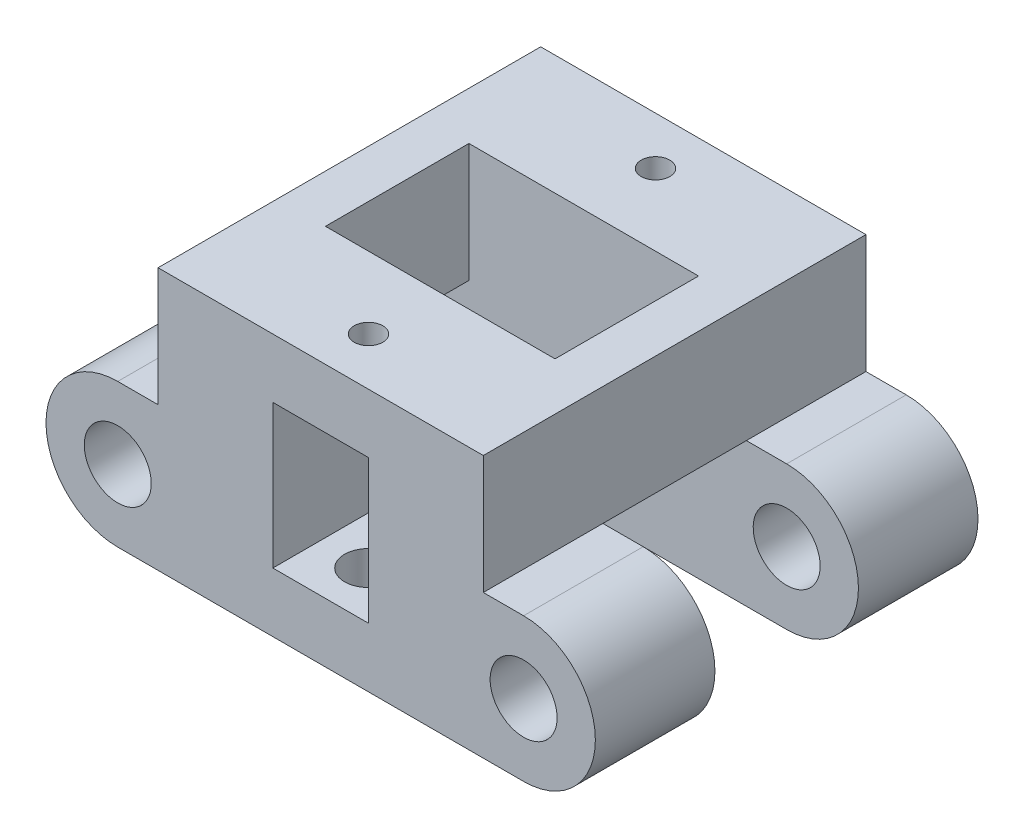
from build123d import *

# Parameters (mm, degrees)
BOSS_EXTRUDE1_DEPTH               = 25.4
BOSS_EXTRUDE1_DEPTH_BACK          = 25.4
SKETCH1_R                         = 4.445
SKETCH9_W                         = 30.48
SKETCH9_H                         = 35.052
CUT_EXTRUDE6_DEPTH                = 75.08914513
BOSS_EXTRUDE3_DEPTH               = 12.7
SKETCH11_W                        = 5.350768363
SKETCH11_H                        = 57.15
CUT_EXTRUDE7_DEPTH                = 94.35417198
SKETCH12_W                        = 30.48
SKETCH12_H                        = 19.05
CUT_EXTRUDE8_DEPTH                = 93.670395825
SKETCH14_R                        = 1.6
CUT_EXTRUDE9_DEPTH                = 81.005571081
SKETCH15_R                        = 3.429
CUT_EXTRUDE10_DEPTH               = 81.005571081
CUT_EXTRUDE11_DEPTH               = 2.778125
SKETCH22_W                        = 1.89865
SKETCH22_H                        = 38.369875
SKETCH23_R                        = 3.175
CUT_EXTRUDE12_DEPTH               = 22.225
SKETCH24_W                        = 43.18
SKETCH24_H                        = 41.402
CUT_EXTRUDE13_DEPTH               = 94.35417198
CUT_EXTRUDE14_REACH               = 74.389
SKETCH25_W                        = 12.7
SKETCH25_H                        = 19.05
CUT_EXTRUDE15_DEPTH               = 74.112136493
CUT_EXTRUDE15_DEPTH_BACK          = 74.112136493
SKETCH26_W                        = 19.05
SKETCH26_H                        = 61.020370042
F_25_0_1495_DIAMETER_HOLE1_REACH  = 58.443
F_25_0_1495_DIAMETER_HOLE1_BORE_R = 1.89865


with BuildPart() as part:
    # Sketch1 → Boss-Extrude1 (new, two sides: drawn at the far end of the back side and taken through both)
    with BuildSketch(Plane.XY.offset(-BOSS_EXTRUDE1_DEPTH_BACK)):
        with BuildLine():
            Line((-26.940768363, -17.415768363), (-26.940768363, 39.734231637))
            Line((-26.940768363, 39.734231637), (26.940768363, 39.734231637))
            Line((26.940768363, 39.734231637), (26.940768363, -17.415768363))
            ThreePointArc((26.940768363, -17.415768363), (36.465768363, -26.940768363), (26.940768363, -36.465768363))
            Line((26.940768363, -36.465768363), (-26.940768363, -36.465768363))
            ThreePointArc((-26.940768363, -36.465768363), (-36.465768363, -26.940768363), (-26.940768363, -17.415768363))
        make_face()
        with Locations((-26.940768363, -26.940768363)):
            Circle(SKETCH1_R, mode=Mode.SUBTRACT)
        with Locations((26.940768363, -26.940768363)):
            Circle(SKETCH1_R, mode=Mode.SUBTRACT)
    extrude(amount=BOSS_EXTRUDE1_DEPTH + BOSS_EXTRUDE1_DEPTH_BACK)

    # Sketch9 → Cut-Extrude6 (cut, through all)
    with BuildSketch(Plane.XY.offset(25.4)):
        with Locations((0, 22.208231637)):
            Rectangle(SKETCH9_W, SKETCH9_H)
    extrude(amount=-CUT_EXTRUDE6_DEPTH, mode=Mode.SUBTRACT)

    # Sketch10 → Boss-Extrude3 (add)
    with BuildSketch(Plane.XY.offset(25.4)):
        Polygon((-26.940768363, 39.734231637), (-26.940768363, -1.667768363), (26.940768363, -1.667768363), (26.940768363, 39.734231637), (15.24, 39.734231637), (15.24, 4.682231637), (-15.24, 4.682231637), (-15.24, 39.734231637), align=None)
    boss_extrude3 = extrude(amount=BOSS_EXTRUDE3_DEPTH)

    # Mirror4: Boss-Extrude3 across plane
    add(boss_extrude3.mirror(Plane.XY))

    # Sketch11 → Cut-Extrude7 (cut, through all)
    with BuildSketch(Plane.XY.offset(38.1)):
        with Locations((-24.265384181, 11.159231637)):
            Rectangle(SKETCH11_W, SKETCH11_H)
    cut_extrude7 = extrude(amount=-CUT_EXTRUDE7_DEPTH, mode=Mode.SUBTRACT)

    # Mirror5: Cut-Extrude7 across plane
    add(cut_extrude7.mirror(Plane(origin=(0, 0, 0), x_dir=(0, 0, 1), z_dir=(1, 0, 0))), mode=Mode.SUBTRACT)

    # Sketch12 → Cut-Extrude8 (cut, through all)
    with BuildSketch(Plane.XZ.offset(36.465768363)):
        Rectangle(SKETCH12_W, SKETCH12_H)
    extrude(amount=-CUT_EXTRUDE8_DEPTH, mode=Mode.SUBTRACT)

    # Sketch14 → Cut-Extrude9 (cut, through all)
    with BuildSketch(Plane.ZY.offset(21.59)):
        with Locations(Location((-18.4, 22.462231637, 0), (0, 0, 90))):
            Circle(SKETCH14_R)
    cut_extrude9 = extrude(amount=-CUT_EXTRUDE9_DEPTH, mode=Mode.SUBTRACT)

    # Mirror6: Cut-Extrude9 across plane
    add(cut_extrude9.mirror(Plane.XY), mode=Mode.SUBTRACT)

    # Sketch15 → Cut-Extrude10 (cut, through all)
    with BuildSketch(Plane(origin=(21.59, 0, 0), x_dir=(0, 0, -1), z_dir=(1, 0, 0))):
        with Locations(Location((0, 22.462231637, 0), (0, 0, 90))):
            Circle(SKETCH15_R)
    extrude(amount=-CUT_EXTRUDE10_DEPTH, mode=Mode.SUBTRACT)

    # Sketch18 → Cut-Extrude11 (cut)
    with BuildSketch(Plane(origin=(0, 4.682231637, 0), x_dir=(1, 0, 0), z_dir=(0, 1, 0))):
        Polygon((-15.24, 2.346351494), (-19.304, 4.692702988), (-23.368, 2.346351494), (-23.368, -2.346351494), (-19.304, -4.692702988), (-15.24, -2.346351494), align=None)
    cut_extrude11 = extrude(amount=-CUT_EXTRUDE11_DEPTH, mode=Mode.SUBTRACT)

    # Mirror7: Cut-Extrude11 across plane
    add(cut_extrude11.mirror(Plane(origin=(0, 0, 0), x_dir=(0, 0, 1), z_dir=(1, 0, 0))), mode=Mode.SUBTRACT)

    # Sketch22 → #6 Clearance Hole1 (revolve, cut)
    with BuildSketch(Plane(origin=(0, 1.904106637, -19.05), x_dir=(0, 0, 1), z_dir=(1, 0, 0))):
        with Locations((0.949325, 19.1849375)):
            Rectangle(SKETCH22_W, SKETCH22_H)
    f_6_clearance_hole1 = revolve(axis=Axis((0, 8.254106637, -19.05), (0, -1, 0)), mode=Mode.SUBTRACT)

    # Mirror8: #6 Clearance Hole1 across plane
    add(f_6_clearance_hole1.mirror(Plane.XY), mode=Mode.SUBTRACT)

    # Sketch23 → Cut-Extrude12 (cut)
    with BuildSketch(Plane.XZ.offset(36.465768363)):
        with Locations(Location((0, -19.05, 0), (0, 0, 270))):
            Circle(SKETCH23_R)
        with Locations(Location((0, 19.05, 0), (0, 0, 270))):
            Circle(SKETCH23_R)
    extrude(amount=-CUT_EXTRUDE12_DEPTH, mode=Mode.SUBTRACT)

    # Sketch24 → Cut-Extrude13 (cut, through all)
    with BuildSketch(Plane(origin=(0, 0, -38.1), x_dir=(-1, 0, 0), z_dir=(0, 0, -1))):
        with Locations((0, 19.033231637)):
            Rectangle(SKETCH24_W, SKETCH24_H)
    extrude(amount=-CUT_EXTRUDE13_DEPTH, mode=Mode.SUBTRACT)

    # Sketch25 → Cut-Extrude14 (cut, up to next)
    with BuildSketch(Plane.XY.offset(25.4), mode=Mode.PRIVATE) as cut_extrude14_sk1:
        with Locations((0, -19.05)):
            Rectangle(SKETCH25_W, SKETCH25_H)
    cut_extrude14_tool1 = extrude(cut_extrude14_sk1.sketch, amount=-CUT_EXTRUDE14_REACH, mode=Mode.PRIVATE) & part.part
    add(cut_extrude14_tool1.solids().sort_by_distance((0, -19.05, 25.4))[0], mode=Mode.SUBTRACT)

    # Sketch26 → Cut-Extrude15 (cut, two sides: drawn at the far end of the back side and taken through both)
    with BuildSketch(Plane(origin=(21.59, 0, 0), x_dir=(0, 0, -1), z_dir=(1, 0, 0)).offset(-CUT_EXTRUDE15_DEPTH_BACK)):
        with Locations((0, -47.925953384)):
            Rectangle(SKETCH26_W, SKETCH26_H)
    extrude(amount=CUT_EXTRUDE15_DEPTH + CUT_EXTRUDE15_DEPTH_BACK, mode=Mode.SUBTRACT)

    # #25 (0.1495) Diameter Hole1 bore → #25 (0.1495) Diameter Hole1 (cut, up to next)
    with BuildSketch(Plane(origin=(0, -36.465768363, 0), x_dir=(-1, 0, 0), z_dir=(0, -1, 0)), mode=Mode.PRIVATE) as f_25_0_1495_diameter_hole1_sk1:
        with Locations((26.940768363, -17.4625)):
            Circle(F_25_0_1495_DIAMETER_HOLE1_BORE_R)
    f_25_0_1495_diameter_hole1_tool1 = extrude(f_25_0_1495_diameter_hole1_sk1.sketch, amount=-F_25_0_1495_DIAMETER_HOLE1_REACH, mode=Mode.PRIVATE) & part.part
    # #25 (0.1495) Diameter Hole1 bore → #25 (0.1495) Diameter Hole1 (cut, up to next)
    with BuildSketch(Plane(origin=(0, -36.465768363, 0), x_dir=(-1, 0, 0), z_dir=(0, -1, 0)), mode=Mode.PRIVATE) as f_25_0_1495_diameter_hole1_sk2:
        with Locations((26.940768363, 17.4625)):
            Circle(F_25_0_1495_DIAMETER_HOLE1_BORE_R)
    f_25_0_1495_diameter_hole1_tool2 = extrude(f_25_0_1495_diameter_hole1_sk2.sketch, amount=-F_25_0_1495_DIAMETER_HOLE1_REACH, mode=Mode.PRIVATE) & part.part
    # #25 (0.1495) Diameter Hole1 bore → #25 (0.1495) Diameter Hole1 (cut, up to next)
    with BuildSketch(Plane(origin=(0, -36.465768363, 0), x_dir=(-1, 0, 0), z_dir=(0, -1, 0)), mode=Mode.PRIVATE) as f_25_0_1495_diameter_hole1_sk3:
        with Locations((-26.940768363, 17.4625)):
            Circle(F_25_0_1495_DIAMETER_HOLE1_BORE_R)
    f_25_0_1495_diameter_hole1_tool3 = extrude(f_25_0_1495_diameter_hole1_sk3.sketch, amount=-F_25_0_1495_DIAMETER_HOLE1_REACH, mode=Mode.PRIVATE) & part.part
    # #25 (0.1495) Diameter Hole1 bore → #25 (0.1495) Diameter Hole1 (cut, up to next)
    with BuildSketch(Plane(origin=(0, -36.465768363, 0), x_dir=(-1, 0, 0), z_dir=(0, -1, 0)), mode=Mode.PRIVATE) as f_25_0_1495_diameter_hole1_sk4:
        with Locations((-26.940768363, -17.4625)):
            Circle(F_25_0_1495_DIAMETER_HOLE1_BORE_R)
    f_25_0_1495_diameter_hole1_tool4 = extrude(f_25_0_1495_diameter_hole1_sk4.sketch, amount=-F_25_0_1495_DIAMETER_HOLE1_REACH, mode=Mode.PRIVATE) & part.part
    add(f_25_0_1495_diameter_hole1_tool1.solids().sort_by_distance((-26.940768, -36.465768, 17.4625))[0], mode=Mode.SUBTRACT)
    add(f_25_0_1495_diameter_hole1_tool2.solids().sort_by_distance((-26.940768, -36.465768, -17.4625))[0], mode=Mode.SUBTRACT)
    add(f_25_0_1495_diameter_hole1_tool3.solids().sort_by_distance((26.940768, -36.465768, -17.4625))[0], mode=Mode.SUBTRACT)
    add(f_25_0_1495_diameter_hole1_tool4.solids().sort_by_distance((26.940768, -36.465768, 17.4625))[0], mode=Mode.SUBTRACT)


solid = part.part
